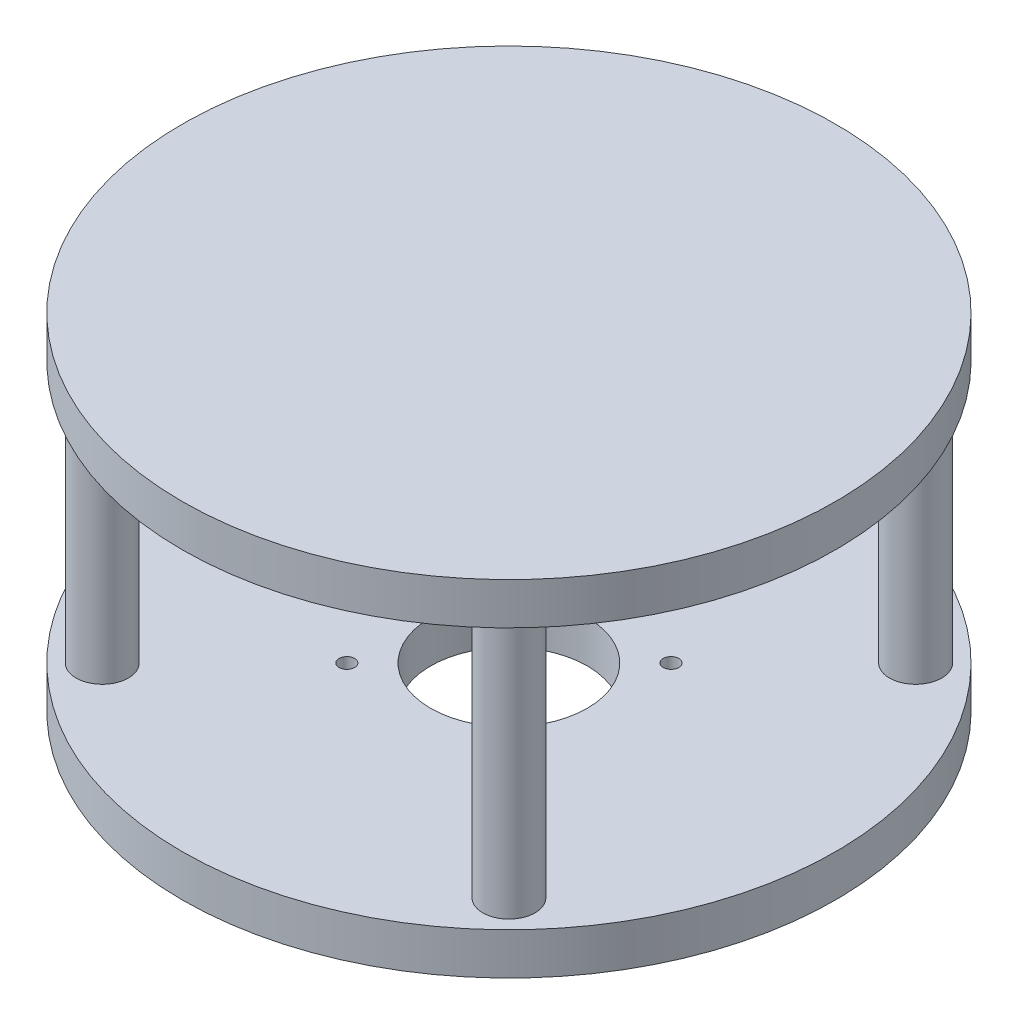
from build123d import *

# Parameters (mm, degrees)
SKETCH_2_R          = 62.5
EXTRUDE_1_DEPTH     = 8
SKETCH_3_R          = 5
EXTRUDE_2_DEPTH     = 50
SKETCH_4_R          = 62.5
EXTRUDE_3_DEPTH     = 8
CUT_EXTRUDE_1_REACH = 112.311
SKETCH_5_R          = 15
CUT_EXTRUDE_2_REACH = 112.311
SKETCH_6_R          = 1.5


with BuildPart() as part:
    # 草图2 → 凸台-拉伸1 (new body)
    with BuildSketch(Plane(origin=(0, 0, 0), x_dir=(1, 0, 0), z_dir=(0, 1, 0))):
        with Locations(Location((0, 0, 0), (0, 0, 270))):
            Circle(SKETCH_2_R)
    extrude(amount=EXTRUDE_1_DEPTH)

    # 草图3 → 凸台-拉伸2 (add)
    with BuildSketch(Plane(origin=(0, 8, 0), x_dir=(1, 0, 0), z_dir=(0, 1, 0))):
        with Locations(Location((38.890872965, 38.890872965, 0), (0, 0, 270))):
            Circle(SKETCH_3_R)
        with Locations(Location((38.890872965, -38.890872965, 0), (0, 0, 270))):
            Circle(SKETCH_3_R)
        with Locations(Location((-38.890872965, -38.890872965, 0), (0, 0, 270))):
            Circle(SKETCH_3_R)
        with Locations(Location((-38.890872965, 38.890872965, 0), (0, 0, 270))):
            Circle(SKETCH_3_R)
    extrude(amount=EXTRUDE_2_DEPTH)

    # 草图4 → 凸台-拉伸3 (add)
    with BuildSketch(Plane(origin=(0, 58, 0), x_dir=(1, 0, 0), z_dir=(0, 1, 0))):
        with Locations(Location((0, 0, 0), (0, 0, 270))):
            Circle(SKETCH_4_R)
    extrude(amount=EXTRUDE_3_DEPTH)

    # 草图5 → 切除-拉伸1 (cut, up to next)
    with BuildSketch(Plane.XZ, mode=Mode.PRIVATE) as cut_extrude_1_sk1:
        with Locations(Location((0, 0, 0), (0, 0, 270))):
            Circle(SKETCH_5_R)
    cut_extrude_1_tool1 = extrude(cut_extrude_1_sk1.sketch, amount=-CUT_EXTRUDE_1_REACH, mode=Mode.PRIVATE) & part.part
    add(cut_extrude_1_tool1.solids().sort_by_distance((0, 0, 0))[0], mode=Mode.SUBTRACT)

    # 草图6 → 切除-拉伸2 (cut, up to next)
    with BuildSketch(Plane(origin=(0, 0, 0), x_dir=(-1, 0, 0), z_dir=(0, -1, 0)), mode=Mode.PRIVATE) as cut_extrude_2_sk1:
        with Locations(Location((15.5, -15.5, 0), (0, 0, 90))):
            Circle(SKETCH_6_R)
    cut_extrude_2_tool1 = extrude(cut_extrude_2_sk1.sketch, amount=-CUT_EXTRUDE_2_REACH, mode=Mode.PRIVATE) & part.part
    # 草图6 → 切除-拉伸2 (cut, up to next)
    with BuildSketch(Plane(origin=(0, 0, 0), x_dir=(-1, 0, 0), z_dir=(0, -1, 0)), mode=Mode.PRIVATE) as cut_extrude_2_sk2:
        with Locations(Location((15.5, 15.5, 0), (0, 0, 270))):
            Circle(SKETCH_6_R)
    cut_extrude_2_tool2 = extrude(cut_extrude_2_sk2.sketch, amount=-CUT_EXTRUDE_2_REACH, mode=Mode.PRIVATE) & part.part
    # 草图6 → 切除-拉伸2 (cut, up to next)
    with BuildSketch(Plane(origin=(0, 0, 0), x_dir=(-1, 0, 0), z_dir=(0, -1, 0)), mode=Mode.PRIVATE) as cut_extrude_2_sk3:
        with Locations(Location((-15.5, -15.5, 0), (0, 0, 270))):
            Circle(SKETCH_6_R)
    cut_extrude_2_tool3 = extrude(cut_extrude_2_sk3.sketch, amount=-CUT_EXTRUDE_2_REACH, mode=Mode.PRIVATE) & part.part
    # 草图6 → 切除-拉伸2 (cut, up to next)
    with BuildSketch(Plane(origin=(0, 0, 0), x_dir=(-1, 0, 0), z_dir=(0, -1, 0)), mode=Mode.PRIVATE) as cut_extrude_2_sk4:
        with Locations(Location((-15.5, 15.5, 0), (0, 0, 90))):
            Circle(SKETCH_6_R)
    cut_extrude_2_tool4 = extrude(cut_extrude_2_sk4.sketch, amount=-CUT_EXTRUDE_2_REACH, mode=Mode.PRIVATE) & part.part
    add(cut_extrude_2_tool1.solids().sort_by_distance((-15.5, 0, 15.5))[0], mode=Mode.SUBTRACT)
    add(cut_extrude_2_tool2.solids().sort_by_distance((-15.5, 0, -15.5))[0], mode=Mode.SUBTRACT)
    add(cut_extrude_2_tool3.solids().sort_by_distance((15.5, 0, 15.5))[0], mode=Mode.SUBTRACT)
    add(cut_extrude_2_tool4.solids().sort_by_distance((15.5, 0, -15.5))[0], mode=Mode.SUBTRACT)


solid = part.part
